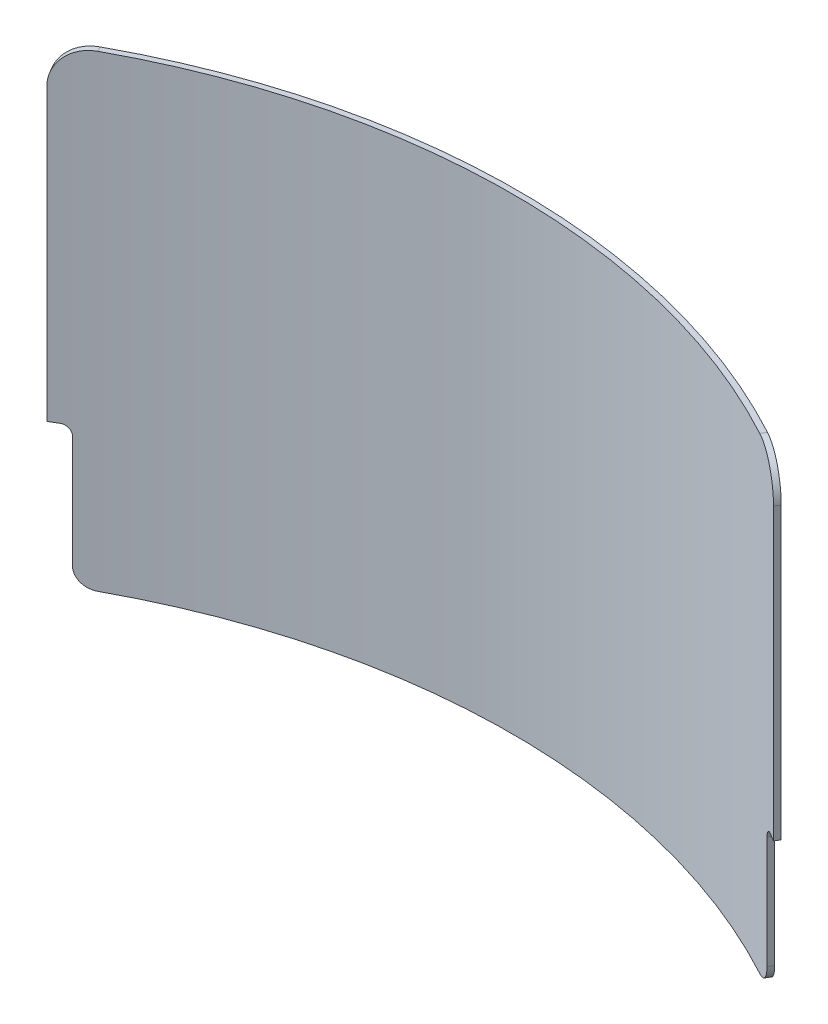
from build123d import *

# Parameters (mm, degrees)
EXTRUS_O_FINA1_DEPTH   = 125
ESBO_O3_W              = 10
ESBO_O3_H              = 75
CORTE_EXTRUS_O1_DEPTH  = 10
FILETE5_R              = 5
FILETE6_R              = 20
FILETE5_OF_ESPELHAR6_R = 5
FILETE8_R              = 10


with BuildPart() as part:
    # Esboço2 → Extrusão-Fina1 (new, symmetric)
    with BuildSketch(Plane(origin=(0, 0, 0), x_dir=(1, 0, 0), z_dir=(0, 1, 0))):
        with BuildLine():
            ThreePointArc((-194.216199756, -56.278928136), (0, -1.5), (194.216199756, -56.278928136))
            Line((194.216199756, -56.278928136), (195.783800244, -53.721071864))
            ThreePointArc((195.783800244, -53.721071864), (0, 1.5), (-195.783800244, -53.721071864))
            Line((-195.783800244, -53.721071864), (-194.216199756, -56.278928136))
        make_face()
    extrude(amount=EXTRUS_O_FINA1_DEPTH, both=True)

    # Esboço3 → Corte-extrusão1 (cut)
    with BuildSketch(Plane(origin=(166.260657734, 0, 101.894031669), x_dir=(0.5225334957369068, 0, -0.8526187576126673), z_dir=(0.8526187576126673, 0, 0.5225334957369068))):
        with Locations((55.5, -87.5)):
            Rectangle(ESBO_O3_W, ESBO_O3_H)
    corte_extrus_o1 = extrude(amount=-CORTE_EXTRUS_O1_DEPTH, mode=Mode.SUBTRACT)

    # Filete5
    filete5_edges = [part.edges().sort_by_distance(p)[0] for p in [
        (186.403788141, -50, 49.888923779),
    ]]
    fillet(filete5_edges, radius=FILETE5_R)

    # Filete6
    filete6_edges = [part.edges().sort_by_distance(p)[0] for p in [
        (-195, 125, 55),
        (195, 125, 55),
    ]]
    fillet(filete6_edges, radius=FILETE6_R)

    # Espelhar6: Corte-extrusão1 across plane
    add(corte_extrus_o1.mirror(Plane(origin=(0, 0, 0), x_dir=(0, 0, 1), z_dir=(1, 0, 0))), mode=Mode.SUBTRACT)

    # Filete5 of Espelhar6
    filete5_of_espelhar6_edges = [part.edges().sort_by_distance(p)[0] for p in [
        (-186.403788141, -50, 49.888923779),
    ]]
    fillet(filete5_of_espelhar6_edges, radius=FILETE5_OF_ESPELHAR6_R)

    # Filete8
    filete8_edges = [part.edges().sort_by_distance(p)[0] for p in [
        (186.403788141, -125, 49.888923779),
        (-186.403788141, -125, 49.888923779),
    ]]
    fillet(filete8_edges, radius=FILETE8_R)


solid = part.part
